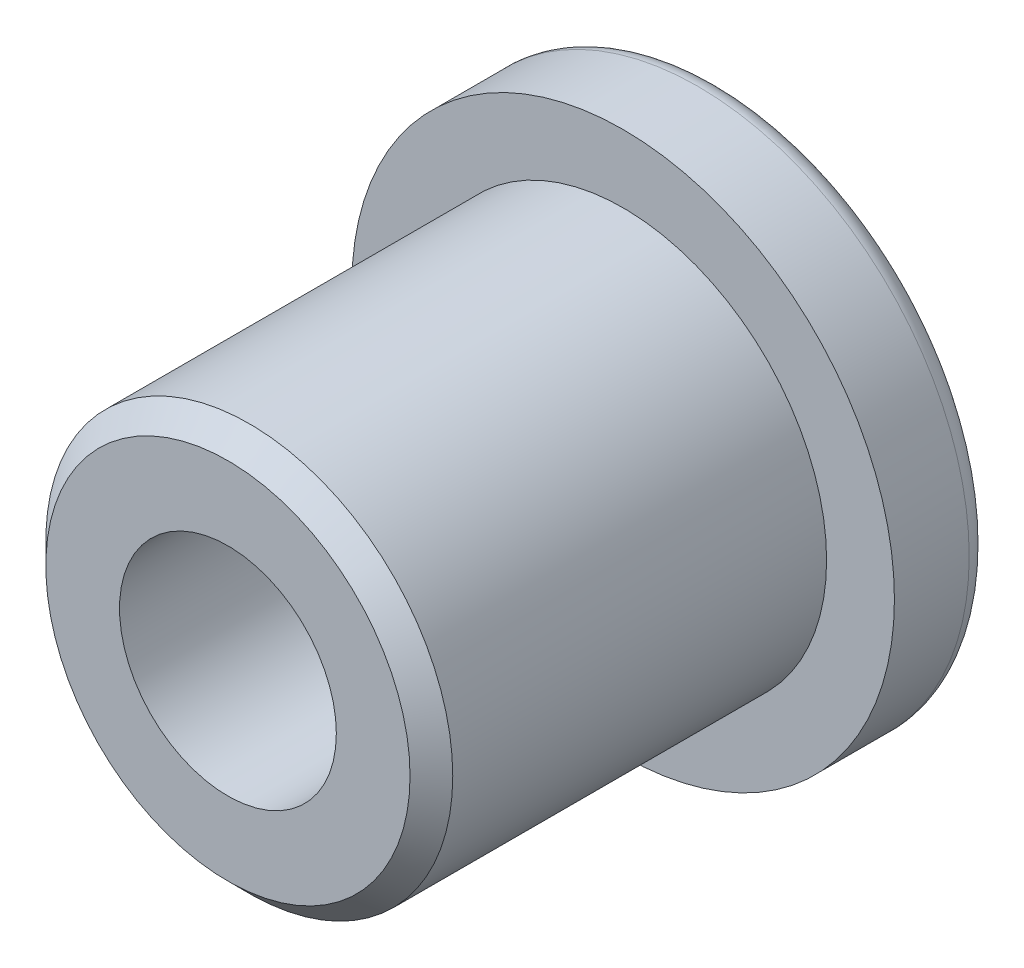
from build123d import *

# Parameters (mm, degrees)
SKETCH_1_R          = 12.7
SKETCH_1_R_2        = 3.75
EXTRUDE_1_DEPTH     = 3
SKETCH_2_R          = 9.525
SKETCH_2_R_2        = 5.075
EXTRUDE_2_DEPTH     = 20
CHAMFER_1_SIZE      = 1
FILLET_1_R          = 1
SKETCH_3_R          = 12.7
SKETCH_3_R_2        = 9.525
EXTRUDE_3_DEPTH     = 1.5
SKETCH_4_R          = 5.075
SKETCH_4_R_2        = 3.75
EXTRUDE_4_DEPTH     = 7.8
SKETCH_5_R          = 5.5
CUT_EXTRUDE_1_DEPTH = 7.5
CHAMFER_2_SIZE      = 1


with BuildPart() as part:
    # 스케치1 → 보스-돌출1 (new body)
    with BuildSketch(Plane.XY):
        Circle(SKETCH_1_R)
        Circle(SKETCH_1_R_2, mode=Mode.SUBTRACT)
    extrude(amount=EXTRUDE_1_DEPTH)

    # 스케치2 → 보스-돌출2 (add)
    with BuildSketch(Plane.XY.offset(3)):
        Circle(SKETCH_2_R)
        Circle(SKETCH_2_R_2, mode=Mode.SUBTRACT)
    extrude(amount=EXTRUDE_2_DEPTH)

    # 모따기1
    chamfer_1_edges = [part.edges().sort_by_distance(p)[0] for p in [
        (-9.525, 0, 23),
    ]]
    chamfer(chamfer_1_edges, length=CHAMFER_1_SIZE)

    # 필렛1
    fillet_1_edges = [part.edges().sort_by_distance(p)[0] for p in [
        (-12.7, 0, 0),
    ]]
    fillet(fillet_1_edges, radius=FILLET_1_R)

    # 스케치3 → 보스-돌출3 (add)
    with BuildSketch(Plane.XY.offset(3)):
        Circle(SKETCH_3_R)
        Circle(SKETCH_3_R_2, mode=Mode.SUBTRACT)
    extrude(amount=EXTRUDE_3_DEPTH)

    # 스케치4 → 보스-돌출4 (add)
    with BuildSketch(Plane.XY.offset(3)):
        Circle(SKETCH_4_R)
        Circle(SKETCH_4_R_2, mode=Mode.SUBTRACT)
    extrude(amount=EXTRUDE_4_DEPTH)

    # 스케치5 → 컷-돌출1 (cut)
    with BuildSketch(Plane(origin=(0, 0, 0), x_dir=(-1, 0, 0), z_dir=(0, 0, -1))):
        Circle(SKETCH_5_R)
    extrude(amount=-CUT_EXTRUDE_1_DEPTH, mode=Mode.SUBTRACT)

    # 모따기2
    chamfer_2_edges = [part.edges().sort_by_distance(p)[0] for p in [
        (5.5, 0, 7.5),
        (5.5, 0, 0),
    ]]
    chamfer(chamfer_2_edges, length=CHAMFER_2_SIZE)


solid = part.part
